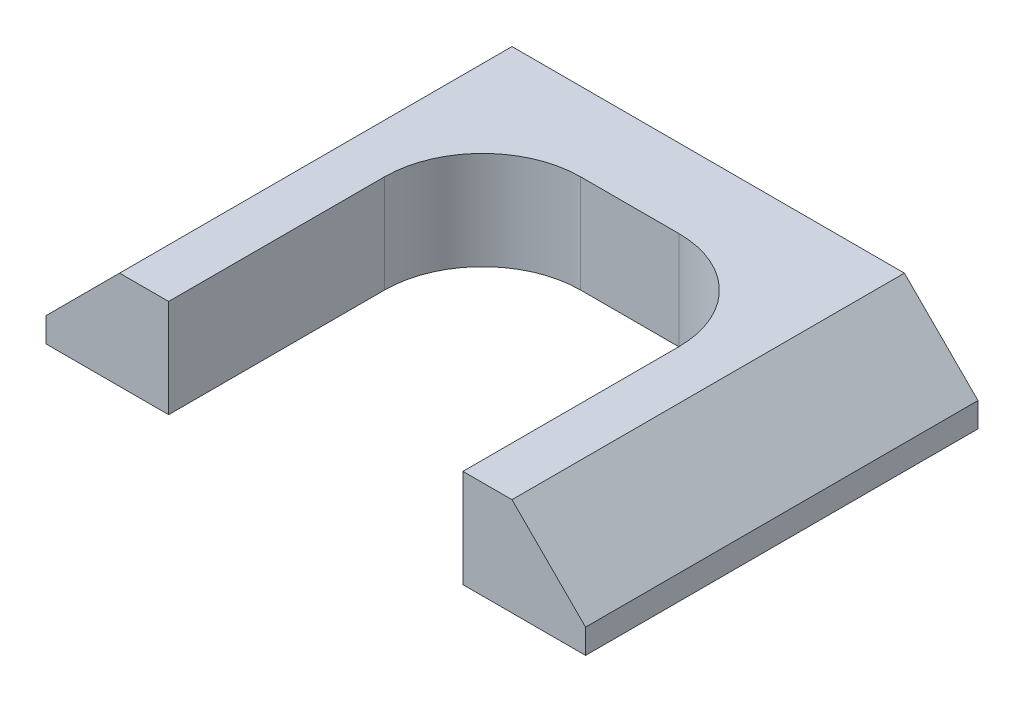
from build123d import *

# Parameters (mm, degrees)
BOSS_EXTRUDE1_DEPTH = 50.8
SKETCH2_W           = 38.1
SKETCH2_H           = 40.64
CUT_EXTRUDE1_DEPTH  = 76.2
FILLET1_R           = 12.7
SKETCH3_OUTSIDE_W   = 96.692
SKETCH3_OUTSIDE_H   = 33.192
SKETCH3_OUTSIDE_W_2 = 69.85
SKETCH3_OUTSIDE_H_2 = 12.7
CUT_EXTRUDE2_DEPTH  = 93.457395594


with BuildPart() as part:
    # Sketch1 → Boss-Extrude1 (new body)
    with BuildSketch(Plane.XY):
        Polygon((0, 0), (76.2, 0), (63.5, 12.7), (12.7, 12.7), align=None)
    extrude(amount=BOSS_EXTRUDE1_DEPTH)

    # Sketch2 → Cut-Extrude1 (cut)
    with BuildSketch(Plane(origin=(0, 12.7, 0), x_dir=(1, 0, 0), z_dir=(0, 1, 0))):
        with Locations((38.1, -30.48)):
            Rectangle(SKETCH2_W, SKETCH2_H)
    extrude(amount=-CUT_EXTRUDE1_DEPTH, mode=Mode.SUBTRACT)

    # Fillet1
    fillet1_edges = [part.edges().sort_by_distance(p)[0] for p in [
        (19.05, 6.35, 10.16),
        (57.15, 6.35, 10.16),
    ]]
    fillet(fillet1_edges, radius=FILLET1_R)

    # Sketch3 outside → Cut-Extrude2 (cut, through all)
    with BuildSketch(Plane(origin=(0, 0, 0), x_dir=(-1, 0, 0), z_dir=(0, 0, -1))):
        with Locations((-38.1, 6.35)):
            Rectangle(SKETCH3_OUTSIDE_W, SKETCH3_OUTSIDE_H)
        with Locations((-38.1, 6.35)):
            Rectangle(SKETCH3_OUTSIDE_W_2, SKETCH3_OUTSIDE_H_2, mode=Mode.SUBTRACT)
    extrude(amount=-CUT_EXTRUDE2_DEPTH, mode=Mode.SUBTRACT)


solid = part.part
